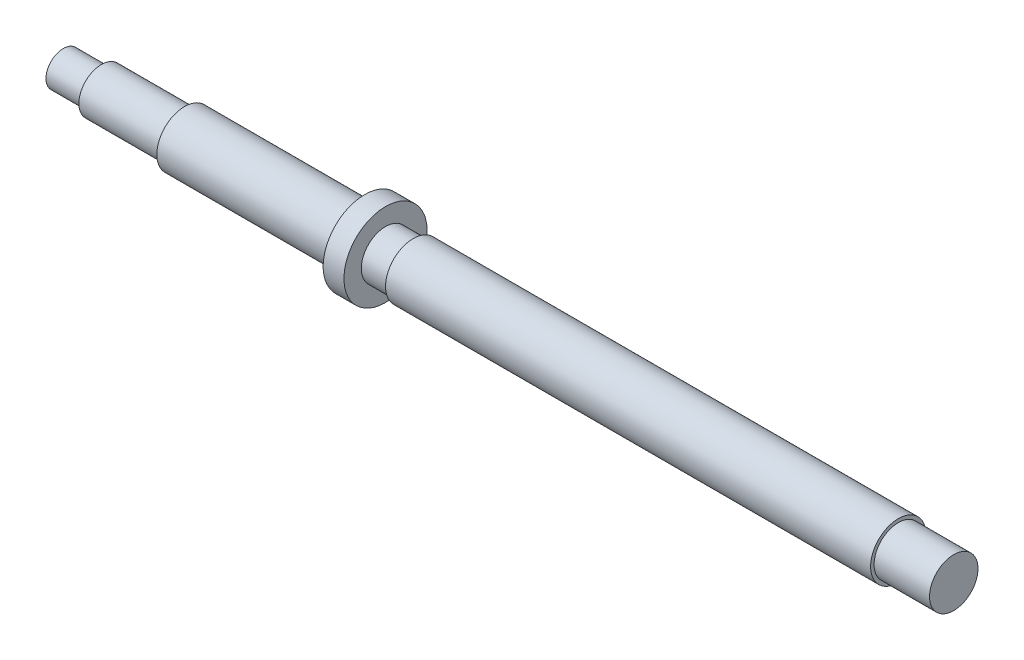
from build123d import *


with BuildPart() as part:
    # Sketch1 → Revolve1 (revolve)
    with BuildSketch(Plane.XY, mode=Mode.PRIVATE) as revolve1_sk:
        Polygon((-128.5, 0), (-128.5, 5), (-117.5, 5), (-117.5, 6.5), (-93.5, 6.5), (-93.5, 8), (-41.5, 8), (-41.5, 12), (-35.5, 12), (-35.5, 7), (-27.5, 7), (-27.5, 8), (112.5, 8), (112.5, 7), (128.5, 7), (128.5, 0), align=None)
    revolve(revolve1_sk.sketch.rotate(Axis((128.5, 0, 0), (-1, 0, 0)), 90), axis=Axis((128.5, 0, 0), (-1, 0, 0)))


solid = part.part
